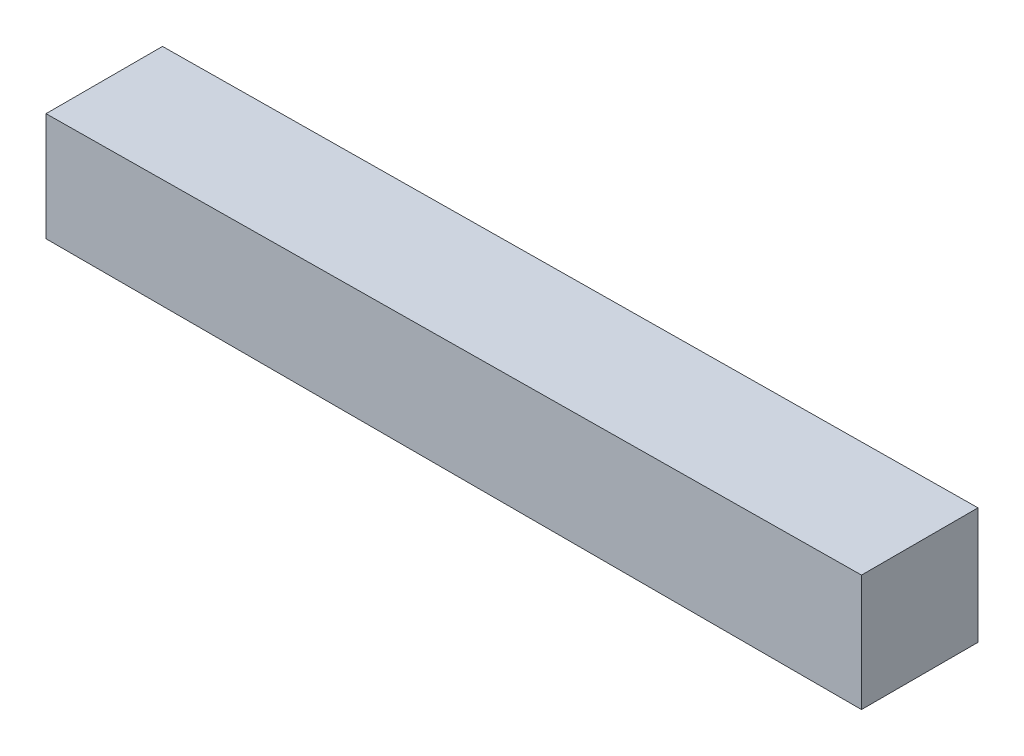
from build123d import *

# Parameters (mm, degrees)
BOSS_EXTRUDE1_DEPTH = 2.5


with BuildPart() as part:
    # Sketch1 → Boss-Extrude1 (new, symmetric)
    with BuildSketch(Plane.XY):
        Polygon((17.5, 2.5), (17.5, -2.5), (-17.5, -2.5), (-17.5, 2.15), align=None)
    extrude(amount=BOSS_EXTRUDE1_DEPTH, both=True)


solid = part.part
